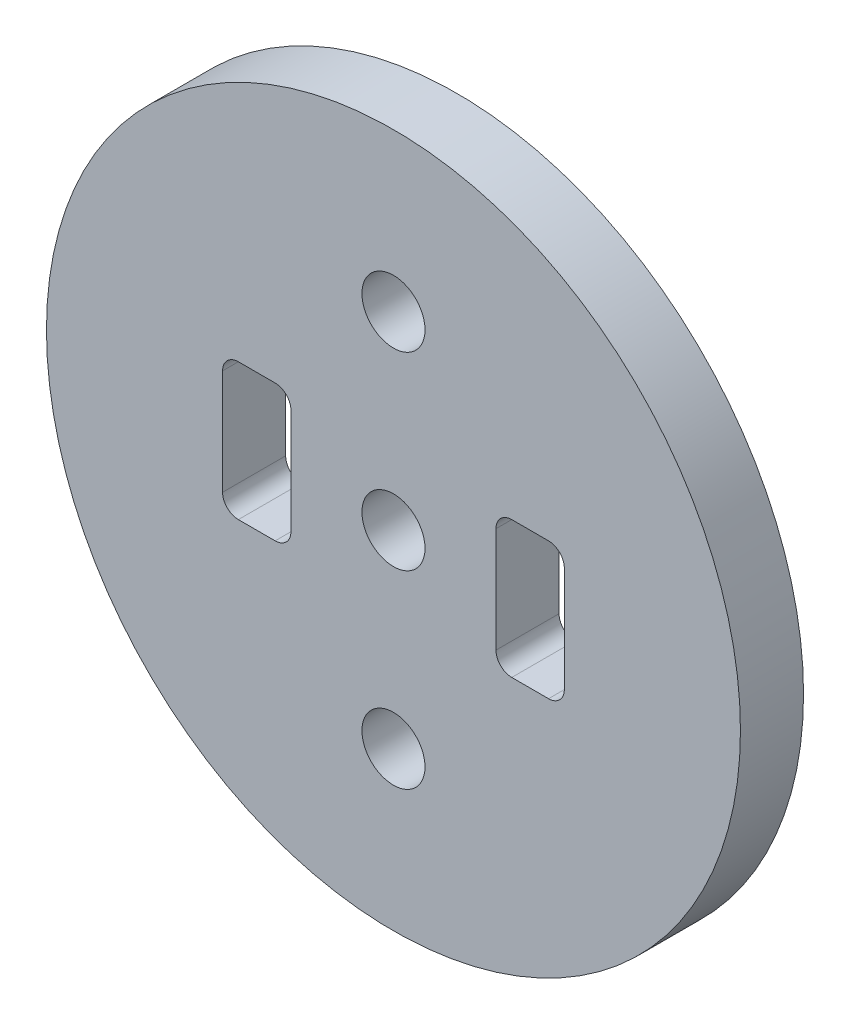
from build123d import *

# Parameters (mm, degrees)
MODEL_R                 = 16.5
MODEL_R_2               = 1.5
SALIENTE_EXTRUIR1_DEPTH = 3


with BuildPart() as part:
    # Model → Saliente-Extruir1 (new body)
    with BuildSketch(Plane.XY):
        with Locations((215.747807914, 241.952019993)):
            Circle(MODEL_R)
        with Locations((215.747807914, 241.952019993)):
            Circle(MODEL_R_2, mode=Mode.SUBTRACT)
        with Locations((215.747807914, 232.952019993)):
            Circle(MODEL_R_2, mode=Mode.SUBTRACT)
        with Locations((215.747807914, 250.952019993)):
            Circle(MODEL_R_2, mode=Mode.SUBTRACT)
        with BuildLine():
            Line((223.122807913, 245.202019993), (221.372807913, 245.202019993))
            ThreePointArc((221.372807913, 245.202019993), (220.842477828, 244.982350079), (220.622807913, 244.452019993))
            Line((220.622807913, 244.452019993), (220.622807913, 239.452019993))
            ThreePointArc((220.622807913, 239.452019993), (220.842477828, 238.921689907), (221.372807913, 238.702019993))
            Line((221.372807913, 238.702019993), (223.122807913, 238.702019993))
            ThreePointArc((223.122807913, 238.702019993), (223.653137999, 238.921689907), (223.872807913, 239.452019993))
            Line((223.872807913, 239.452019993), (223.872807913, 244.452019993))
            ThreePointArc((223.872807913, 244.452019993), (223.653137999, 244.982350079), (223.122807913, 245.202019993))
        make_face(mode=Mode.SUBTRACT)
        with BuildLine():
            Line((208.372807913, 245.202019993), (210.122807913, 245.202019993))
            ThreePointArc((210.122807913, 245.202019993), (210.653137999, 244.982350079), (210.872807913, 244.452019993))
            Line((210.872807913, 244.452019993), (210.872807913, 239.452019993))
            ThreePointArc((210.872807913, 239.452019993), (210.653137999, 238.921689907), (210.122807913, 238.702019993))
            Line((210.122807913, 238.702019993), (208.372807913, 238.702019993))
            ThreePointArc((208.372807913, 238.702019993), (207.842477828, 238.921689907), (207.622807913, 239.452019993))
            Line((207.622807913, 239.452019993), (207.622807913, 244.452019993))
            ThreePointArc((207.622807913, 244.452019993), (207.842477828, 244.982350079), (208.372807913, 245.202019993))
        make_face(mode=Mode.SUBTRACT)
    extrude(amount=SALIENTE_EXTRUIR1_DEPTH)


solid = part.part
